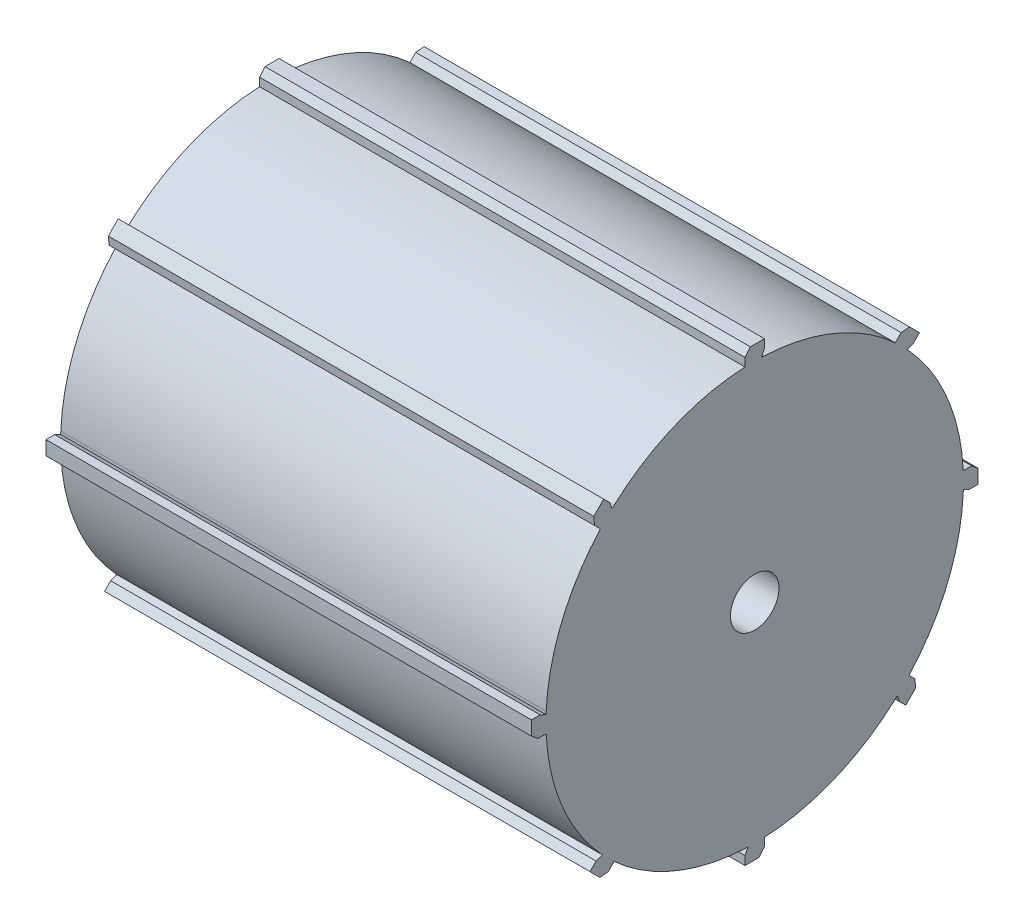
from build123d import *

# Parameters (mm, degrees)
SKETCH1_R           = 2.5
BOSS_EXTRUDE1_DEPTH = 50


with BuildPart() as part:
    # Sketch1 → Boss-Extrude1 (new body)
    # profile 1 of 9: a face of its own
    with BuildSketch(Plane(origin=(0, 0, 0), x_dir=(0, 0, -1), z_dir=(1, 0, 0))):
        with BuildLine():
            Line((-1, 20), (-1, 21.476731595))
            ThreePointArc((-1, 21.476731595), (-8.227693796, 19.863409949), (-14.479235767, 15.89344933))
            Line((-14.479235767, 15.89344933), (-13.435028843, 14.849242405))
            Line((-13.435028843, 14.849242405), (-14.849242405, 13.435028843))
            Line((-14.849242405, 13.435028843), (-15.89344933, 14.479235767))
            ThreePointArc((-15.89344933, 14.479235767), (-19.863409949, 8.227693796), (-21.476731595, 1))
            Line((-21.476731595, 1), (-20, 1))
            Line((-20, 1), (-20, -1))
            Line((-20, -1), (-21.476731595, -1))
            ThreePointArc((-21.476731595, -1), (-19.863409949, -8.227693796), (-15.89344933, -14.479235767))
            Line((-15.89344933, -14.479235767), (-14.849242405, -13.435028843))
            Line((-14.849242405, -13.435028843), (-13.435028843, -14.849242405))
            Line((-13.435028843, -14.849242405), (-14.479235767, -15.89344933))
            ThreePointArc((-14.479235767, -15.89344933), (-8.227693796, -19.863409949), (-1, -21.476731595))
            Line((-1, -21.476731595), (-1, -20))
            Line((-1, -20), (1, -20))
            Line((1, -20), (1, -21.476731595))
            ThreePointArc((1, -21.476731595), (8.227693796, -19.863409949), (14.479235767, -15.89344933))
            Line((14.479235767, -15.89344933), (13.435028843, -14.849242405))
            Line((13.435028843, -14.849242405), (14.849242405, -13.435028843))
            Line((14.849242405, -13.435028843), (15.89344933, -14.479235767))
            ThreePointArc((15.89344933, -14.479235767), (19.863409949, -8.227693796), (21.476731595, -1))
            Line((21.476731595, -1), (20, -1))
            Line((20, -1), (20, 1))
            Line((20, 1), (21.476731595, 1))
            ThreePointArc((21.476731595, 1), (19.863409949, 8.227693796), (15.89344933, 14.479235767))
            Line((15.89344933, 14.479235767), (14.849242405, 13.435028843))
            Line((14.849242405, 13.435028843), (13.435028843, 14.849242405))
            Line((13.435028843, 14.849242405), (14.479235767, 15.89344933))
            ThreePointArc((14.479235767, 15.89344933), (8.227693796, 19.863409949), (1, 21.476731595))
            Line((1, 21.476731595), (1, 20))
            Line((1, 20), (-1, 20))
        make_face()
        Circle(SKETCH1_R, mode=Mode.SUBTRACT)
    # profile 2 of 9: a face of its own
    with BuildSketch(Plane(origin=(0, 0, 0), x_dir=(0, 0, -1), z_dir=(1, 0, 0))):
        Polygon((-1, 22.331430068), (-1, 20), (1, 20), (1, 21.476731595), (0.706241247, 21.488397411), (1, 22.107441235), (1, 23), (-0.450054938, 23), align=None)
    # profile 3 of 9: a face of its own
    with BuildSketch(Plane(origin=(0, 0, 0), x_dir=(0, 0, -1), z_dir=(1, 0, 0))):
        Polygon((-14.695203551, 15.693979501), (-14.925214831, 16.339428393), (-15.556349186, 16.970562748), (-16.581692866, 15.945219069), (-16.497812416, 15.083598853), (-14.849242405, 13.435028843), (-13.435028843, 14.849242405), (-14.479235767, 15.89344933), align=None)
    # profile 4 of 9: a face of its own
    with BuildSketch(Plane(origin=(0, 0, 0), x_dir=(0, 0, -1), z_dir=(1, 0, 0))):
        Polygon((-21.488397411, 0.706241247), (-22.107441235, 1), (-23, 1), (-23, -0.450054938), (-22.331430068, -1), (-20, -1), (-20, 1), (-21.476731595, 1), align=None)
    # profile 5 of 9: a face of its own
    with BuildSketch(Plane(origin=(0, 0, 0), x_dir=(0, 0, -1), z_dir=(1, 0, 0))):
        Polygon((-15.693979501, -14.695203551), (-16.339428393, -14.925214831), (-16.970562748, -15.556349186), (-15.945219069, -16.581692866), (-15.083598853, -16.497812416), (-13.435028843, -14.849242405), (-14.849242405, -13.435028843), (-15.89344933, -14.479235767), align=None)
    # profile 6 of 9: a face of its own
    with BuildSketch(Plane(origin=(0, 0, 0), x_dir=(0, 0, -1), z_dir=(1, 0, 0))):
        Polygon((16.581692866, -15.945219069), (15.556349186, -16.970562748), (14.925214831, -16.339428393), (14.695203551, -15.693979501), (14.479235767, -15.89344933), (13.435028843, -14.849242405), (14.849242405, -13.435028843), (16.497812416, -15.083598853), align=None)
    # profile 7 of 9: a face of its own
    with BuildSketch(Plane(origin=(0, 0, 0), x_dir=(0, 0, -1), z_dir=(1, 0, 0))):
        Polygon((23, 0.450054938), (23, -1), (22.107441235, -1), (21.488397411, -0.706241247), (21.476731595, -1), (20, -1), (20, 1), (22.331430068, 1), align=None)
    # profile 8 of 9: a face of its own
    with BuildSketch(Plane(origin=(0, 0, 0), x_dir=(0, 0, -1), z_dir=(1, 0, 0))):
        Polygon((13.435028843, 14.849242405), (14.849242405, 13.435028843), (15.89344933, 14.479235767), (15.693979501, 14.695203551), (16.339428393, 14.925214831), (16.970562748, 15.556349186), (15.945219069, 16.581692866), (15.083598853, 16.497812416), align=None)
    # profile 9 of 9: a face of its own
    with BuildSketch(Plane(origin=(0, 0, 0), x_dir=(0, 0, -1), z_dir=(1, 0, 0))):
        Polygon((1, -20), (-1, -20), (-1, -21.476731595), (-0.706241247, -21.488397411), (-1, -22.107441235), (-1, -23), (0.450054938, -23), (1, -22.331430068), align=None)
    extrude(amount=BOSS_EXTRUDE1_DEPTH)


solid = part.part
